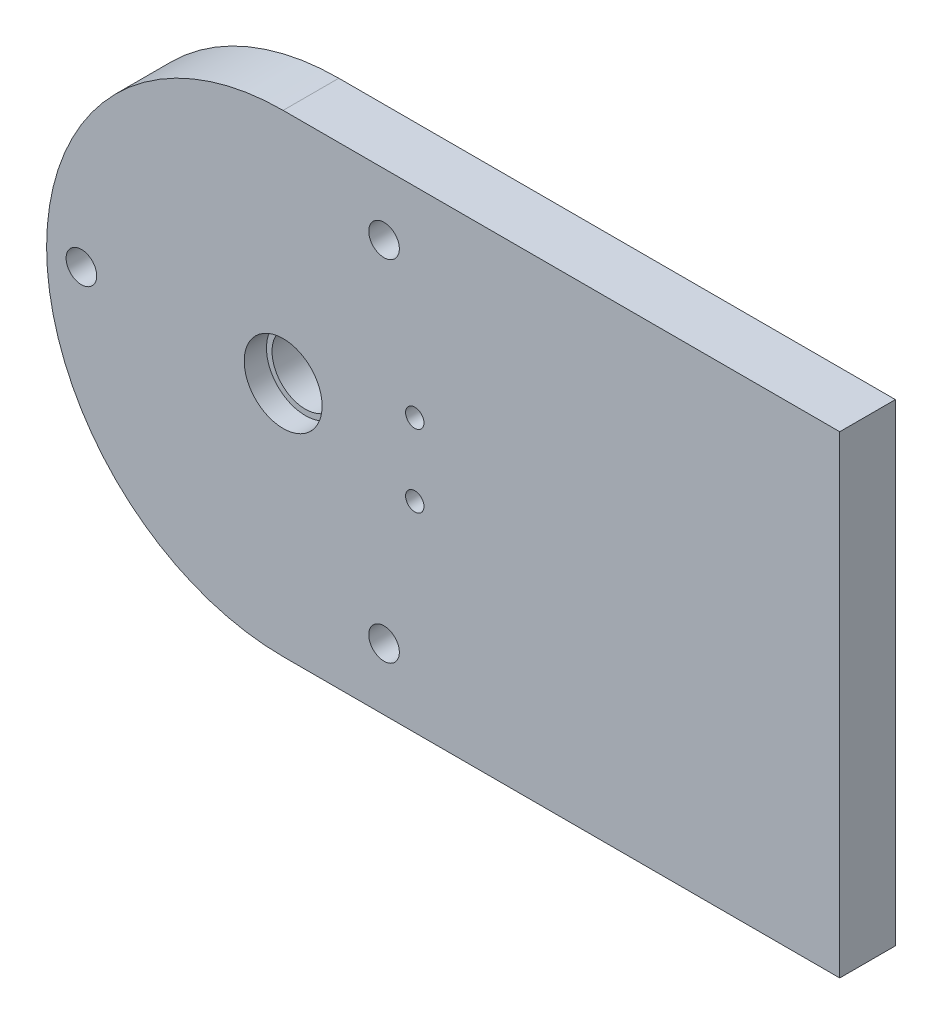
from build123d import *

# Parameters (mm, degrees)
EXTRUDE_1_DEPTH     = 20
SKETCH_2_R          = 14
CUT_EXTRUDE_1_DEPTH = 8
SKETCH_3_R          = 12
CUT_EXTRUDE_2_DEPTH = 218.644205069
SKETCH_4_R          = 5.5
CUT_EXTRUDE_3_DEPTH = 219.231528428
SKETCH_6_R          = 3.3
CUT_EXTRUDE_4_DEPTH = 219.231528428


with BuildPart() as part:
    # 草图1 → 凸台-拉伸1 (new body)
    with BuildSketch(Plane.XY):
        with BuildLine():
            Line((0, 85), (200, 85))
            Line((200, 85), (200, -85))
            Line((200, -85), (0, -85))
            ThreePointArc((0, -85), (-85, 0), (0, 85))
        make_face()
    extrude(amount=EXTRUDE_1_DEPTH)

    # 草图2 → 切除-拉伸1 (cut)
    with BuildSketch(Plane.XY.offset(20)):
        Circle(SKETCH_2_R)
    extrude(amount=-CUT_EXTRUDE_1_DEPTH, mode=Mode.SUBTRACT)

    # 草图3 → 切除-拉伸2 (cut, through all)
    with BuildSketch(Plane.XY.offset(12)):
        Circle(SKETCH_3_R)
    extrude(amount=-CUT_EXTRUDE_2_DEPTH, mode=Mode.SUBTRACT)

    # 草图4 → 切除-拉伸3 (cut, through all)
    with BuildSketch(Plane.XY.offset(20)):
        with Locations((-72.5, 0)):
            Circle(SKETCH_4_R)
        with Locations((36.25, 62.786841774)):
            Circle(SKETCH_4_R)
        with Locations((36.25, -62.786841774)):
            Circle(SKETCH_4_R)
    extrude(amount=-CUT_EXTRUDE_3_DEPTH, mode=Mode.SUBTRACT)

    # 草图6 → 切除-拉伸4 (cut, through all)
    with BuildSketch(Plane.XY.offset(20)):
        with Locations((47.3, 13)):
            Circle(SKETCH_6_R)
        with Locations((47.3, -13)):
            Circle(SKETCH_6_R)
    extrude(amount=-CUT_EXTRUDE_4_DEPTH, mode=Mode.SUBTRACT)


solid = part.part
